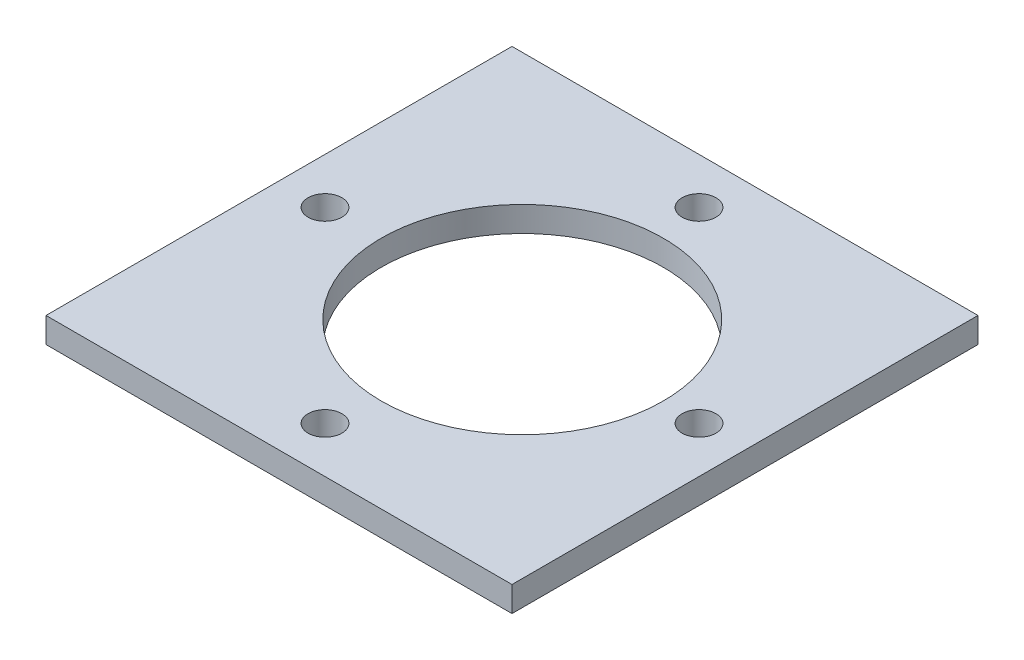
from build123d import *

# Parameters (mm, degrees)
SKETCH1_W           = 82.6
SKETCH1_H           = 82.6
BOSS_EXTRUDE1_DEPTH = 4.47
SKETCH5_R           = 25
CUT_EXTRUDE2_DEPTH  = 117.899533361
SKETCH7_R           = 3
CUT_EXTRUDE3_DEPTH  = 117.899533361


with BuildPart() as part:
    # Sketch1 → Boss-Extrude1 (new body)
    with BuildSketch(Plane(origin=(0, 0, 0), x_dir=(1, 0, 0), z_dir=(0, 1, 0))):
        with Locations((41.3, 41.3)):
            Rectangle(SKETCH1_W, SKETCH1_H)
    extrude(amount=BOSS_EXTRUDE1_DEPTH)

    # Sketch5 → Cut-Extrude2 (cut, through all)
    with BuildSketch(Plane(origin=(0, 4.47, 0), x_dir=(1, 0, 0), z_dir=(0, 1, 0))):
        with Locations(Location((42.841926389, 41.575343998, 0), (0, 0, 270))):
            Circle(SKETCH5_R)
    extrude(amount=-CUT_EXTRUDE2_DEPTH, mode=Mode.SUBTRACT)

    # Sketch7 → Cut-Extrude3 (cut, through all)
    with BuildSketch(Plane(origin=(0, 4.47, 0), x_dir=(1, 0, 0), z_dir=(0, 1, 0))):
        with Locations(Location((8.15, 41.3, 0), (0, 0, 270))):
            Circle(SKETCH7_R)
        with Locations(Location((41.3, 74.45, 0), (0, 0, 270))):
            Circle(SKETCH7_R)
        with Locations(Location((74.45, 41.3, 0), (0, 0, 270))):
            Circle(SKETCH7_R)
        with Locations(Location((41.3, 8.15, 0), (0, 0, 270))):
            Circle(SKETCH7_R)
    extrude(amount=-CUT_EXTRUDE3_DEPTH, mode=Mode.SUBTRACT)


solid = part.part
